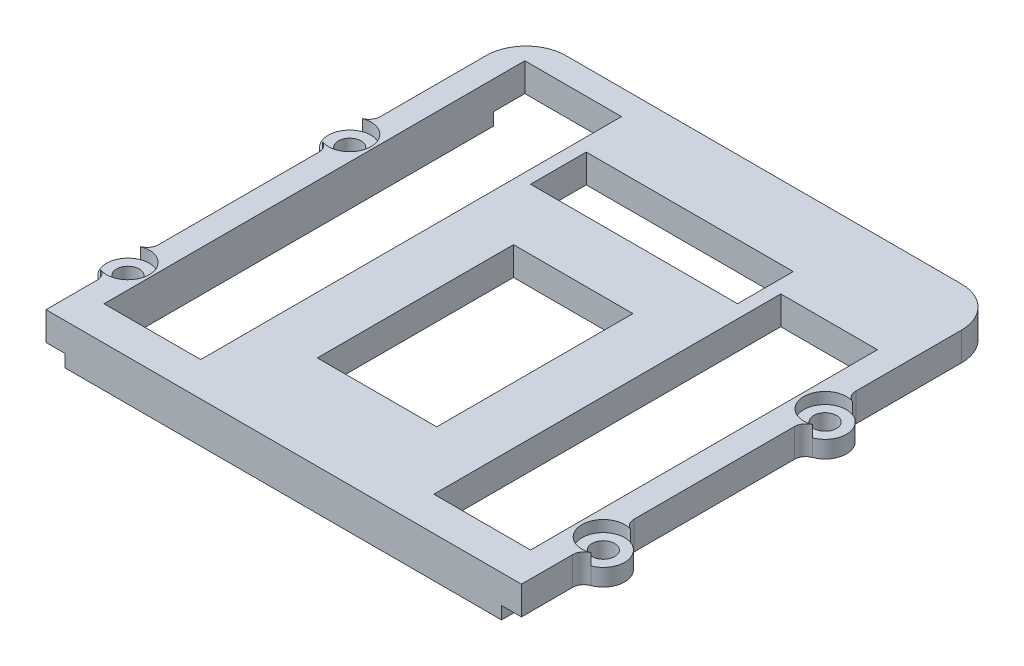
from build123d import *

# Parameters (mm, degrees)
SKETCH1_W           = 132
SKETCH1_H           = 85.5
BOSS_EXTRUDE1_DEPTH = 5
BOSS_EXTRUDE3_DEPTH = 5
FILLET1_R           = 2
SKETCH5_R           = 2
CUT_EXTRUDE1_DEPTH  = 7
SKETCH6_R           = 3.75
CUT_EXTRUDE2_DEPTH  = 2
FILLET2_R           = 7
SKETCH7_W           = 101.652764849
SKETCH7_H           = 21.79377459
CUT_EXTRUDE3_DEPTH  = 90
CUT_EXTRUDE4_DEPTH  = 5
BOSS_EXTRUDE4_DEPTH = 2.2
CUT_EXTRUDE5_DEPTH  = 1.1


with BuildPart() as part:
    # Sketch1 → Boss-Extrude1 (new body)
    with BuildSketch(Plane(origin=(0, 0, 0), x_dir=(1, 0, 0), z_dir=(0, 1, 0))):
        Rectangle(SKETCH1_W, SKETCH1_H)
    extrude(amount=BOSS_EXTRUDE1_DEPTH)

    # Sketch4 → Boss-Extrude3 (add)
    with BuildSketch(Plane(origin=(0, 5, 0), x_dir=(1, 0, 0), z_dir=(0, 1, 0))):
        with BuildLine():
            Line((-66, 15.5), (-66, 8))
            ThreePointArc((-66, 8), (-69.75, 11.75), (-66, 15.5))
        make_face()
        with BuildLine():
            Line((-66, -23.5), (-66, -31))
            ThreePointArc((-66, -31), (-69.75, -27.25), (-66, -23.5))
        make_face()
        with BuildLine():
            Line((66, -31), (66, -23.5))
            ThreePointArc((66, -23.5), (69.75, -27.25), (66, -31))
        make_face()
        with BuildLine():
            Line((66, 8), (66, 15.5))
            ThreePointArc((66, 15.5), (69.75, 11.75), (66, 8))
        make_face()
    extrude(amount=-BOSS_EXTRUDE3_DEPTH)

    # Fillet1
    fillet1_edges = [part.edges().sort_by_distance(p)[0] for p in [
        (-66, 2.5, -8),
        (-66, 2.5, -15.5),
        (-66, 2.5, 31),
        (-66, 2.5, 23.5),
        (66, 2.5, 23.5),
        (66, 2.5, 31),
        (66, 2.5, -15.5),
        (66, 2.5, -8),
    ]]
    fillet(fillet1_edges, radius=FILLET1_R)

    # Sketch5 → Cut-Extrude1 (cut)
    with BuildSketch(Plane(origin=(0, 5, 0), x_dir=(1, 0, 0), z_dir=(0, 1, 0))):
        with Locations(Location((-66, 11.75, 0), (0, 0, 270))):
            Circle(SKETCH5_R)
        with Locations(Location((66, 11.75, 0), (0, 0, 270))):
            Circle(SKETCH5_R)
        with Locations(Location((66, -27.25, 0), (0, 0, 270))):
            Circle(SKETCH5_R)
        with Locations(Location((-66, -27.25, 0), (0, 0, 270))):
            Circle(SKETCH5_R)
    extrude(amount=-CUT_EXTRUDE1_DEPTH, mode=Mode.SUBTRACT)

    # Sketch6 → Cut-Extrude2 (cut)
    with BuildSketch(Plane(origin=(0, 5, 0), x_dir=(1, 0, 0), z_dir=(0, 1, 0))):
        with Locations((-66, 11.75)):
            Circle(SKETCH6_R)
        with Locations((-66, -27.25)):
            Circle(SKETCH6_R)
        with Locations((66, -27.25)):
            Circle(SKETCH6_R)
        with Locations((66, 11.75)):
            Circle(SKETCH6_R)
    extrude(amount=-CUT_EXTRUDE2_DEPTH, mode=Mode.SUBTRACT)

    # Fillet2
    fillet2_edges = [part.edges().sort_by_distance(p)[0] for p in [
        (-66, 2.5, -42.75),
        (66, 2.5, -42.75),
    ]]
    fillet(fillet2_edges, radius=FILLET2_R)

    # Sketch7 → Cut-Extrude3 (cut)
    with BuildSketch(Plane.XY.offset(42.75)):
        with Locations((26.626382425, 4.310675182)):
            Rectangle(SKETCH7_W, SKETCH7_H)
    extrude(amount=-CUT_EXTRUDE3_DEPTH, mode=Mode.SUBTRACT)

    # Mirror1: part across plane


with BuildPart() as part_1:
    add(part.part)
    add(part.part.mirror(Plane(origin=(-24.2, 15.207562477, -47.25), x_dir=(0, 0, 1), z_dir=(-1, 0, 0))))

    # Sketch9 → Cut-Extrude4 (cut)
    with BuildSketch(Plane(origin=(0, 5, 0), x_dir=(1, 0, 0), z_dir=(0, 1, 0))):
        Polygon((-44.8, -26.35), (-44.8, 38.35), (-61.8, 38.35), (-61.8, -26.35), (-61.8, -35.65), (-44.8, -35.65), align=None)
        Polygon((-34.8, -25.15), (-23.1, -25.15), (-13.8, -25.15), (-13.8, -8.65), (-13.8, 9.35), (-23.1, 9.35), (-34.8, 9.35), (-34.8, -8.65), align=None)
        Polygon((13.2, -26.35), (13.2, -35.65), (-3.8, -35.65), (-3.8, -26.35), (-3.8, 25.35), (13.2, 25.35), align=None)
        Polygon((-22.6, 29.85), (-42.5, 29.85), (-42.5, 20.05), (-6.1, 20.05), (-6.1, 29.85), align=None)
    extrude(amount=-CUT_EXTRUDE4_DEPTH, mode=Mode.SUBTRACT)

    # Sketch11 → Boss-Extrude4 (add)
    with BuildSketch(Plane.XZ):
        Polygon((14.1, 42.75), (-62.7, 42.75), (-62.7, -32.810601847), (-61.8, -32.810601847), (-61.8, 40.250110422), (13.2, 40.250110422), (13.2, -32.810601847), (14.1, -32.810601847), align=None)
    extrude(amount=BOSS_EXTRUDE4_DEPTH)

    # Sketch12 → Cut-Extrude5 (cut)
    with BuildSketch(Plane.XY.offset(42.75)):
        Polygon((-66, 0), (-62.7, 0), (-62.7, -2.2), (14.1, -2.2), (14.1, 0), (17.6, 0), (17.6, 5), (-66, 5), align=None)
    extrude(amount=-CUT_EXTRUDE5_DEPTH, mode=Mode.SUBTRACT)


solid = part_1.part
